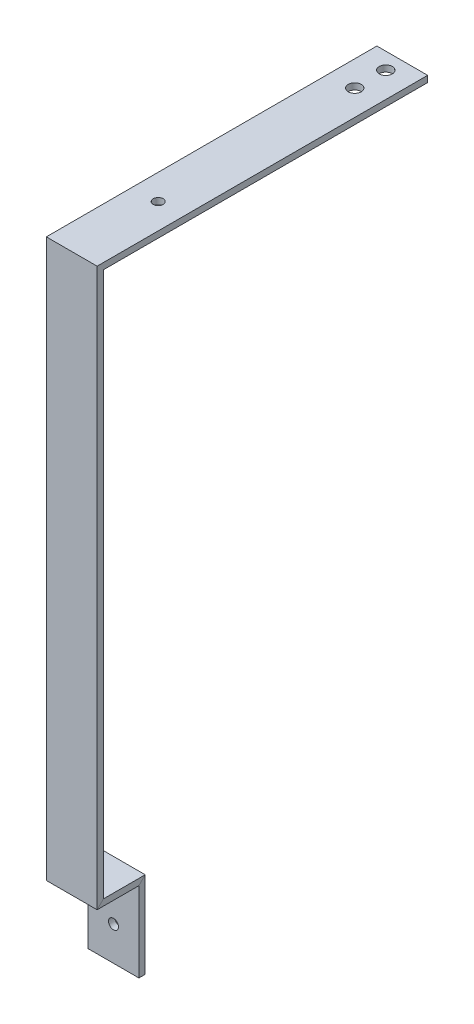
from build123d import *

# Parameters (mm, degrees)
CROQUIS1_W              = 50.8
CROQUIS1_H              = 6.31
SALIENTE_EXTRUIR1_DEPTH = 330.7
CROQUIS3_W              = 50.8
CROQUIS3_H              = 6.31
SALIENTE_EXTRUIR2_DEPTH = 538.2
CROQUIS7_W              = 50.8
CROQUIS7_H              = 6.31
CROQUIS8_R              = 5
CORTAR_EXTRUIR2_DEPTH   = 15.875
CROQUIS9_R              = 6.5
CORTAR_EXTRUIR3_DEPTH   = 15.875
CROQUIS11_R             = 5
CORTAR_EXTRUIR5_DEPTH   = 10


with BuildPart() as part:
    # Croquis1 → Saliente-Extruir1 (new body)
    with BuildSketch(Plane.XY):
        Rectangle(CROQUIS1_W, CROQUIS1_H)
    extrude(amount=SALIENTE_EXTRUIR1_DEPTH)

    # Croquis3 → Saliente-Extruir2 (add)
    with BuildSketch(Plane.XZ.offset(3.155)):
        with Locations((0, 327.545)):
            Rectangle(CROQUIS3_W, CROQUIS3_H)
    extrude(amount=SALIENTE_EXTRUIR2_DEPTH)

    # Barrer1: sweep along a curve in space
    with BuildLine() as barrer1_path:
        Line((0, -541.355, 327.545), (0, -551.355, 327.545))
        Line((0, -551.355, 327.545), (0, -551.355, 285.735))
        Line((0, -551.355, 285.735), (0, -634.515, 285.735))
    # Croquis7 → Barrer1 (sweep)
    with BuildSketch(Plane.XZ.offset(541.355)):
        with Locations((0, 327.545)):
            Rectangle(CROQUIS7_W, CROQUIS7_H)
    sweep(path=barrer1_path.line, transition=Transition.RIGHT)

    # Croquis8 → Cortar-Extruir2 (cut)
    with BuildSketch(Plane(origin=(0, 0, 282.58), x_dir=(-1, 0, 0), z_dir=(0, 0, -1))):
        with Locations((0, -600.505)):
            Circle(CROQUIS8_R)
    extrude(amount=-CORTAR_EXTRUIR2_DEPTH, mode=Mode.SUBTRACT)

    # Croquis9 → Cortar-Extruir3 (cut)
    with BuildSketch(Plane(origin=(0, 3.155, 0), x_dir=(1, 0, 0), z_dir=(0, 1, 0))):
        with Locations(Location((0, -47.5, 0), (0, 0, 270))):
            Circle(CROQUIS9_R)
        with Locations(Location((0, -16.5, 0), (0, 0, 270))):
            Circle(CROQUIS9_R)
    extrude(amount=-CORTAR_EXTRUIR3_DEPTH, mode=Mode.SUBTRACT)

    # Croquis11 → Cortar-Extruir5 (cut)
    with BuildSketch(Plane(origin=(0, 3.155, 0), x_dir=(1, 0, 0), z_dir=(0, 1, 0))):
        with Locations(Location((0, -244.19, 0), (0, 0, 270))):
            Circle(CROQUIS11_R)
    extrude(amount=-CORTAR_EXTRUIR5_DEPTH, mode=Mode.SUBTRACT)


solid = part.part
